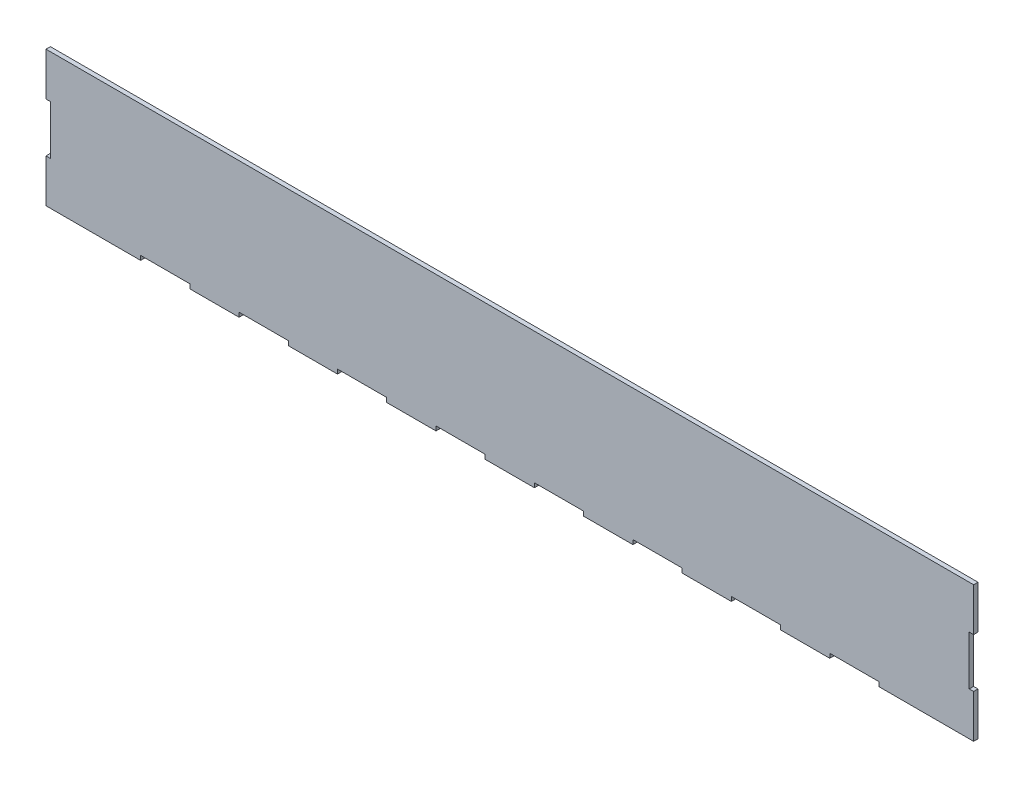
from build123d import *

# Parameters (mm, degrees)
BOSS_EXTRUDE1_DEPTH = 3


with BuildPart() as part:
    # Model → Boss-Extrude1 (new body)
    with BuildSketch(Plane.XY):
        Polygon((0, 96), (0, 66.375), (3, 66.375), (3, 32.625), (0, 32.625), (0, 3), (64.875, 3), (64.875, 6), (98.625, 6), (98.625, 3), (132.375, 3), (132.375, 6), (166.125, 6), (166.125, 3), (199.875, 3), (199.875, 6), (233.625, 6), (233.625, 3), (267.375, 3), (267.375, 6), (301.125, 6), (301.125, 3), (334.875, 3), (334.875, 6), (368.625, 6), (368.625, 3), (402.375, 3), (402.375, 6), (436.125, 6), (436.125, 3), (469.875, 3), (469.875, 6), (503.625, 6), (503.625, 3), (537.375, 3), (537.375, 6), (571.125, 6), (571.125, 3), (604.875, 3), (636, 3), (636, 32.625), (633, 32.625), (633, 66.375), (636, 66.375), (636, 96), align=None)
    extrude(amount=BOSS_EXTRUDE1_DEPTH)


solid = part.part
